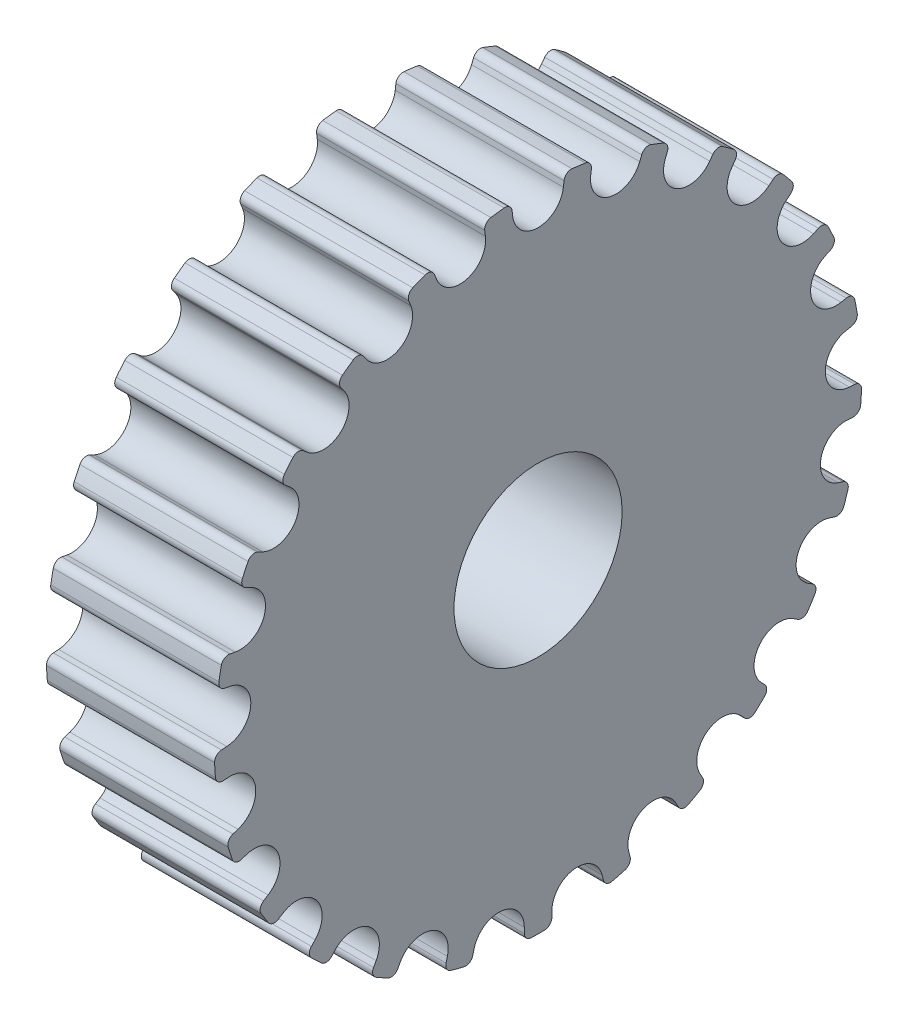
from build123d import *

# Parameters (mm, degrees)
CHAMFER_1_SIZE           = 1
SKETCH_4_W               = 3
SKETCH_4_H               = 1.399999977
CUT_EXTRUDE_1_DEPTH      = 18.855806675
CUT_EXTRUDE_2_REACH      = 19.856
PATTERN_CIRCULAR_3_COUNT = 25
SKETCH_7_R               = 13
CUT_EXTRUDE_3_DEPTH      = 1.2
SKETCH_8_R               = 6.5
EXTRUDE_1_DEPTH          = 6
SKETCH_9_R               = 3
CUT_EXTRUDE_4_DEPTH      = 6


with BuildPart() as part:
    # 草图1 → 旋转1 (revolve)
    with BuildSketch(Plane.XY, mode=Mode.PRIVATE) as revolve_1_sk:
        Polygon((0, 4.3416), (0, 11.554), (6, 11.554), (6, 8.6832), (7.2, 8.6832), (7.2, 4.3416), align=None)
    revolve(revolve_1_sk.sketch.rotate(Axis((0, 0, 0), (1, 0, 0)), 90), axis=Axis((0, 0, 0), (1, 0, 0)))

    # 倒角1
    chamfer_1_edges = [part.edges().sort_by_distance(p)[0] for p in [
        (7.2, 0, -4.3416),
        (0, 0, -4.3416),
    ]]
    chamfer(chamfer_1_edges, length=CHAMFER_1_SIZE)

    # 草图4 → 切除-拉伸1 (cut, through all)
    with BuildSketch(Plane.ZY):
        with Locations((0, 4.774247226)):
            Rectangle(SKETCH_4_W, SKETCH_4_H)
    extrude(amount=-CUT_EXTRUDE_1_DEPTH, mode=Mode.SUBTRACT)

    # 草图6 → 切除-拉伸2 (cut, up to next)
    with BuildSketch(Plane(origin=(0, 0, 0), x_dir=(0, 0, -1), z_dir=(1, 0, 0)), mode=Mode.PRIVATE) as cut_extrude_2_sk1:
        with BuildLine():
            Line((0.926581165, 11.263384769), (0.903216998, 11.073098898))
            ThreePointArc((0.903216998, 11.073098898), (0, 10.274), (-0.903216998, 11.073098898))
            Line((-0.903216998, 11.073098898), (-0.926581165, 11.263384769))
            ThreePointArc((-0.926581165, 11.263384769), (-1.022826488, 11.435206388), (-1.211914921, 11.490264498))
            ThreePointArc((-1.211914921, 11.490264498), (-1.341121086, 11.475901282), (-1.470157464, 11.46008521))
            Line((-1.470157464, 11.46008521), (-1.666805452, 13.061654553))
            ThreePointArc((-1.666805452, 13.061654553), (0, 13.167576089), (1.666805452, 13.061654553))
            Line((1.666805452, 13.061654553), (1.470157464, 11.46008521))
            ThreePointArc((1.470157464, 11.46008521), (1.341121086, 11.475901282), (1.211914921, 11.490264498))
            ThreePointArc((1.211914921, 11.490264498), (1.022826488, 11.435206388), (0.926581165, 11.263384769))
        make_face()
    cut_extrude_2_tool1 = extrude(cut_extrude_2_sk1.sketch, amount=CUT_EXTRUDE_2_REACH, mode=Mode.PRIVATE) & part.part
    cut_extrude_2 = cut_extrude_2_tool1.solids().sort_by_distance((0, 11.963549, 0))[0]
    add(cut_extrude_2, mode=Mode.SUBTRACT)

    # 阵列(圆周)3: 切除-拉伸2 ×25 about axis
    pattern_circular_3_axis = Axis((0, 0, 0), (1, 0, 0))
    for i in range(1, PATTERN_CIRCULAR_3_COUNT):
        add(cut_extrude_2.rotate(pattern_circular_3_axis, i * 360 / PATTERN_CIRCULAR_3_COUNT), mode=Mode.SUBTRACT)

    # 草图7 → 切除-拉伸3 (cut)
    with BuildSketch(Plane(origin=(7.2, 0, 0), x_dir=(0, 0, -1), z_dir=(1, 0, 0))):
        Circle(SKETCH_7_R)
    extrude(amount=-CUT_EXTRUDE_3_DEPTH, mode=Mode.SUBTRACT)

    # 草图8 → 凸台-拉伸1 (add)
    with BuildSketch(Plane.ZY):
        Circle(SKETCH_8_R)
    extrude(amount=-EXTRUDE_1_DEPTH)

    # 草图9 → 切除-拉伸4 (cut)
    with BuildSketch(Plane(origin=(6, 0, 0), x_dir=(0, 0, -1), z_dir=(1, 0, 0))):
        Circle(SKETCH_9_R)
    extrude(amount=-CUT_EXTRUDE_4_DEPTH, mode=Mode.SUBTRACT)


solid = part.part
